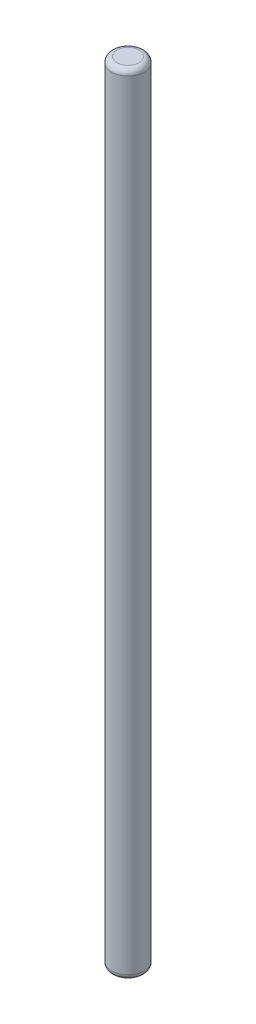
from build123d import *

# Parameters (mm, degrees)
IZIM1_R                     = 1.5
Y_KSEKLIK_EKSTR_ZYON1_DEPTH = 72
RADYUS1_R                   = 0.5
RADYUS2_R                   = 0.5


with BuildPart() as part:
    # Çizim1 → Yükseklik-Ekstrüzyon1 (new body)
    with BuildSketch(Plane(origin=(0, 0, 0), x_dir=(1, 0, 0), z_dir=(0, 1, 0))):
        with Locations(Location((0, 0, 0), (0, 0, 270))):
            Circle(IZIM1_R)
    extrude(amount=Y_KSEKLIK_EKSTR_ZYON1_DEPTH)

    # Radyus1
    radyus1_edges = [part.edges().sort_by_distance(p)[0] for p in [
        (0, 72, -1.5),
    ]]
    fillet(radyus1_edges, radius=RADYUS1_R)

    # Radyus2
    radyus2_edges = [part.edges().sort_by_distance(p)[0] for p in [
        (0, 0, -1.5),
    ]]
    fillet(radyus2_edges, radius=RADYUS2_R)


solid = part.part
